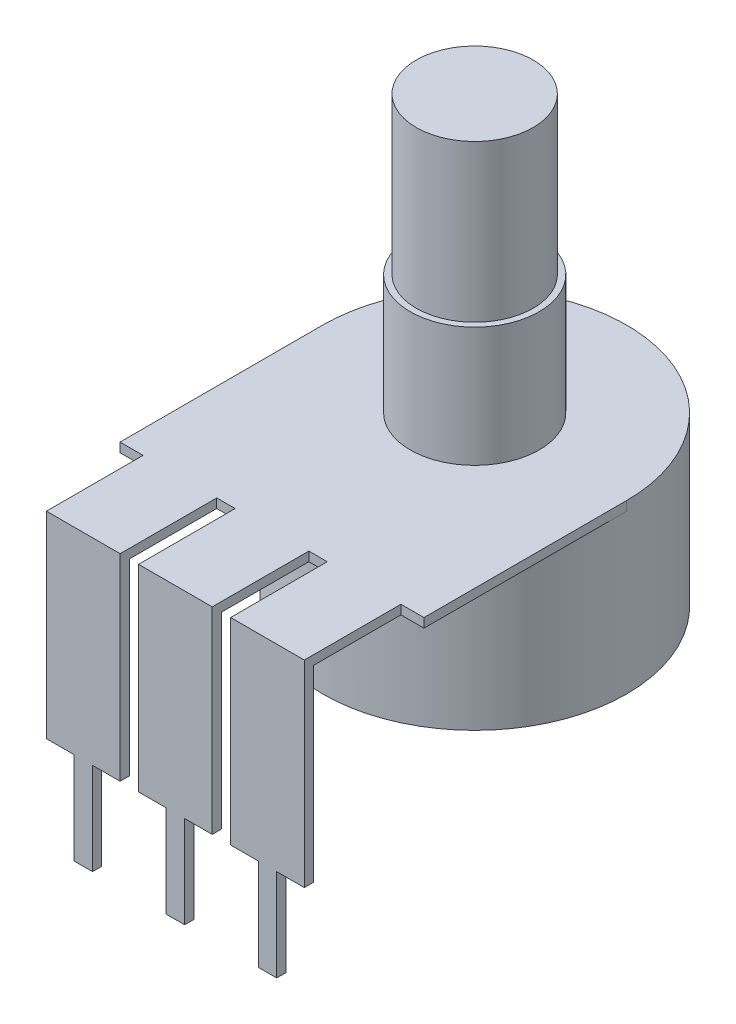
from build123d import *

# Parameters (mm, degrees)
SKETCH1_R           = 8.25
BOSS_EXTRUDE1_DEPTH = 9.1
SKETCH2_R           = 3.5
BOSS_EXTRUDE2_DEPTH = 6.5
SKETCH3_R           = 3.175
BOSS_EXTRUDE3_DEPTH = 8.5
BOSS_EXTRUDE4_START = -0.5
BOSS_EXTRUDE4_DEPTH = 0.5
SKETCH5_W           = 4
SKETCH5_H           = 0.5
BOSS_EXTRUDE5_DEPTH = 10.2
SKETCH6_W           = 1
SKETCH6_H           = 0.5
BOSS_EXTRUDE6_DEPTH = 5
CUT_EXTRUDE1_REACH  = 26.054
SKETCH7_W           = 1.25
SKETCH7_H           = 5.244370441
SKETCH7_W_2         = 1


with BuildPart() as part:
    # Sketch1 → Boss-Extrude1 (new body)
    with BuildSketch(Plane(origin=(0, 0, 0), x_dir=(1, 0, 0), z_dir=(0, 1, 0))):
        with Locations(Location((0, 0, 0), (0, 0, 270))):
            Circle(SKETCH1_R)
    extrude(amount=BOSS_EXTRUDE1_DEPTH)

    # Sketch2 → Boss-Extrude2 (add)
    with BuildSketch(Plane(origin=(0, 9.1, 0), x_dir=(1, 0, 0), z_dir=(0, 1, 0))):
        with Locations(Location((0, 0, 0), (0, 0, 90))):
            Circle(SKETCH2_R)
    extrude(amount=BOSS_EXTRUDE2_DEPTH)

    # Sketch3 → Boss-Extrude3 (add)
    with BuildSketch(Plane(origin=(0, 15.6, 0), x_dir=(1, 0, 0), z_dir=(0, 1, 0))):
        with Locations(Location((0, 0, 0), (0, 0, 270))):
            Circle(SKETCH3_R)
    extrude(amount=BOSS_EXTRUDE3_DEPTH)

    # Sketch4 → Boss-Extrude4 (add)
    with BuildSketch(Plane(origin=(0, 9.1, 0), x_dir=(1, 0, 0), z_dir=(0, 1, 0)).offset(BOSS_EXTRUDE4_START)):
        with BuildLine():
            Line((-8.25, 0), (-8.25, -16.25))
            Line((-8.25, -16.25), (8.25, -16.25))
            Line((8.25, -16.25), (8.25, 0))
            ThreePointArc((8.25, 0), (0, -8.25), (-8.25, 0))
        make_face()
    extrude(amount=BOSS_EXTRUDE4_DEPTH)

    # Sketch5 → Boss-Extrude5 (add)
    with BuildSketch(Plane.XZ.offset(-8.6)):
        with Locations((0, 16)):
            Rectangle(SKETCH5_W, SKETCH5_H)
        with Locations((-5, 16)):
            Rectangle(SKETCH5_W, SKETCH5_H)
        with Locations((5, 16)):
            Rectangle(SKETCH5_W, SKETCH5_H)
    extrude(amount=BOSS_EXTRUDE5_DEPTH)

    # Sketch6 → Boss-Extrude6 (add)
    with BuildSketch(Plane.XZ.offset(1.6)):
        with Locations((5, 16)):
            Rectangle(SKETCH6_W, SKETCH6_H)
        with Locations((0, 16)):
            Rectangle(SKETCH6_W, SKETCH6_H)
        with Locations((-5, 16)):
            Rectangle(SKETCH6_W, SKETCH6_H)
    extrude(amount=BOSS_EXTRUDE6_DEPTH)

    # Sketch7 → Cut-Extrude1 (cut, up to next)
    with BuildSketch(Plane(origin=(0, 9.1, 0), x_dir=(1, 0, 0), z_dir=(0, 1, 0)), mode=Mode.PRIVATE) as cut_extrude1_sk1:
        with Locations((-7.625, -13.627814779)):
            Rectangle(SKETCH7_W, SKETCH7_H)
    cut_extrude1_tool1 = extrude(cut_extrude1_sk1.sketch, amount=-CUT_EXTRUDE1_REACH, mode=Mode.PRIVATE) & part.part
    # Sketch7 → Cut-Extrude1 (cut, up to next)
    with BuildSketch(Plane(origin=(0, 9.1, 0), x_dir=(1, 0, 0), z_dir=(0, 1, 0)), mode=Mode.PRIVATE) as cut_extrude1_sk2:
        with Locations((7.625, -13.627814779)):
            Rectangle(SKETCH7_W, SKETCH7_H)
    cut_extrude1_tool2 = extrude(cut_extrude1_sk2.sketch, amount=-CUT_EXTRUDE1_REACH, mode=Mode.PRIVATE) & part.part
    # Sketch7 → Cut-Extrude1 (cut, up to next)
    with BuildSketch(Plane(origin=(0, 9.1, 0), x_dir=(1, 0, 0), z_dir=(0, 1, 0)), mode=Mode.PRIVATE) as cut_extrude1_sk3:
        with Locations((2.5, -13.627814779)):
            Rectangle(SKETCH7_W_2, SKETCH7_H)
    cut_extrude1_tool3 = extrude(cut_extrude1_sk3.sketch, amount=-CUT_EXTRUDE1_REACH, mode=Mode.PRIVATE) & part.part
    # Sketch7 → Cut-Extrude1 (cut, up to next)
    with BuildSketch(Plane(origin=(0, 9.1, 0), x_dir=(1, 0, 0), z_dir=(0, 1, 0)), mode=Mode.PRIVATE) as cut_extrude1_sk4:
        with Locations((-2.5, -13.627814779)):
            Rectangle(SKETCH7_W_2, SKETCH7_H)
    cut_extrude1_tool4 = extrude(cut_extrude1_sk4.sketch, amount=-CUT_EXTRUDE1_REACH, mode=Mode.PRIVATE) & part.part
    add(cut_extrude1_tool1.solids().sort_by_distance((-7.625, 9.1, 13.627815))[0], mode=Mode.SUBTRACT)
    add(cut_extrude1_tool2.solids().sort_by_distance((7.625, 9.1, 13.627815))[0], mode=Mode.SUBTRACT)
    add(cut_extrude1_tool3.solids().sort_by_distance((2.5, 9.1, 13.627815))[0], mode=Mode.SUBTRACT)
    add(cut_extrude1_tool4.solids().sort_by_distance((-2.5, 9.1, 13.627815))[0], mode=Mode.SUBTRACT)


solid = part.part
